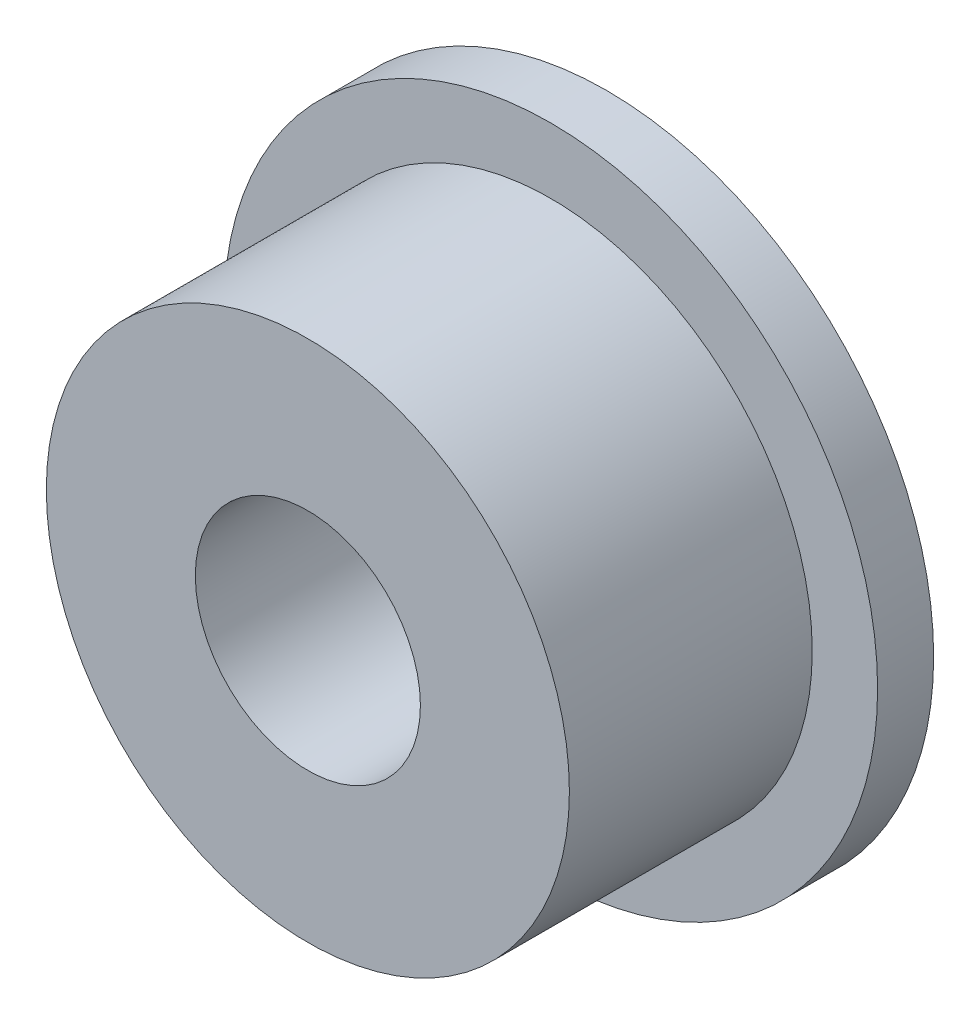
from build123d import *

# Parameters (mm, degrees)
SKETCH_1_R      = 14
SKETCH_1_R_2    = 6.025
EXTRUDE_1_DEPTH = 16
SKETCH_2_R      = 17.5
SKETCH_2_R_2    = 6.025
EXTRUDE_2_DEPTH = 3


with BuildPart() as part:
    # 草图1 → 凸台-拉伸1 (new body)
    with BuildSketch(Plane.XY):
        Circle(SKETCH_1_R)
        Circle(SKETCH_1_R_2, mode=Mode.SUBTRACT)
    extrude(amount=EXTRUDE_1_DEPTH)

    # 草图2 → 凸台-拉伸2 (add)
    with BuildSketch(Plane.XY):
        Circle(SKETCH_2_R)
        Circle(SKETCH_2_R_2, mode=Mode.SUBTRACT)
    extrude(amount=EXTRUDE_2_DEPTH)


solid = part.part
